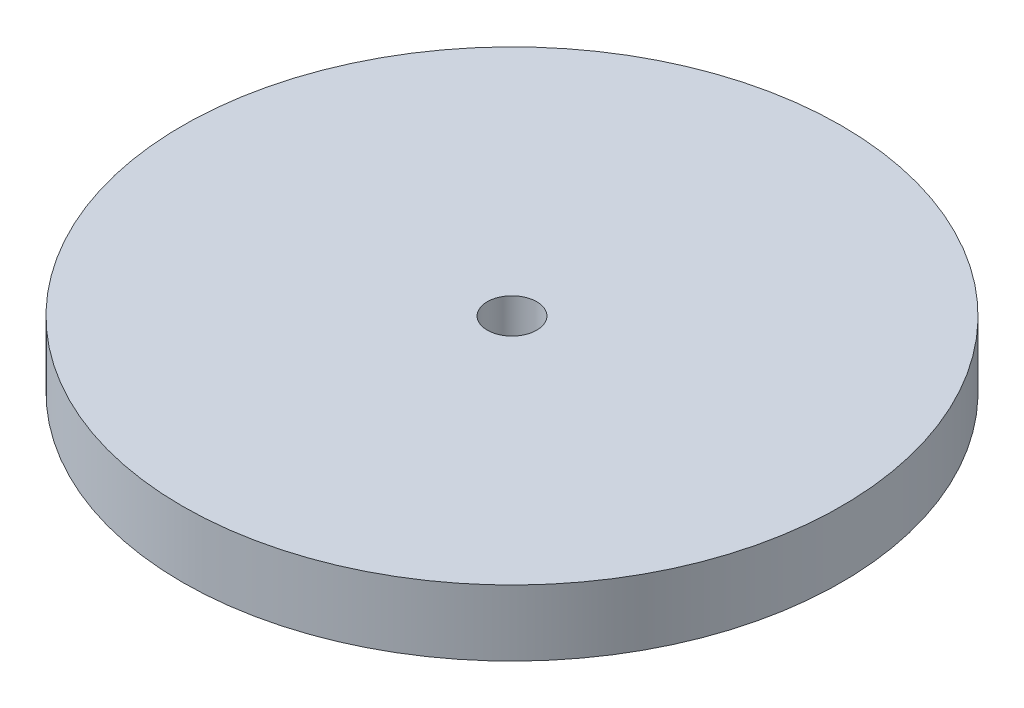
from build123d import *

# Parameters (mm, degrees)
SKETCH1_R           = 10
BOSS_EXTRUDE1_DEPTH = 2
SKETCH2_R           = 0.75
CUT_EXTRUDE1_DEPTH  = 15.282856857


with BuildPart() as part:
    # Sketch1 → Boss-Extrude1 (new body)
    with BuildSketch(Plane(origin=(0, 0, 0), x_dir=(1, 0, 0), z_dir=(0, 1, 0))):
        with Locations(Location((0, 0, 0), (0, 0, 270))):
            Circle(SKETCH1_R)
    extrude(amount=BOSS_EXTRUDE1_DEPTH)

    # Sketch2 → Cut-Extrude1 (cut, through all)
    with BuildSketch(Plane(origin=(0, 2, 0), x_dir=(1, 0, 0), z_dir=(0, 1, 0))):
        with Locations(Location((0, 0, 0), (0, 0, 270))):
            Circle(SKETCH2_R)
    extrude(amount=-CUT_EXTRUDE1_DEPTH, mode=Mode.SUBTRACT)


solid = part.part
